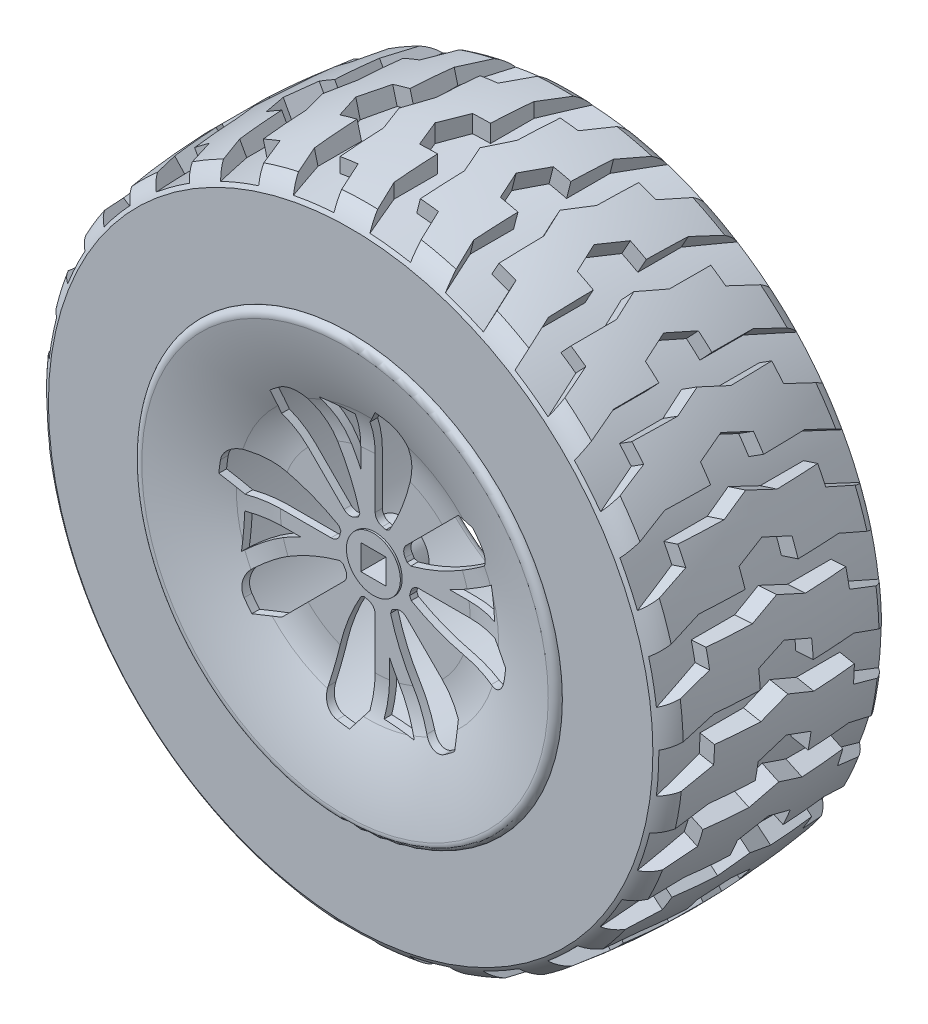
from build123d import *

# Parameters (mm, degrees)
SKETCH1_R           = 42.5
BOSS_EXTRUDE1_DEPTH = 31.5
BOSS_EXTRUDE2_DEPTH = 45
CIRPATTERN1_COUNT   = 25
SKETCH9_W           = 3.5
SKETCH9_H           = 3.5
CUT_EXTRUDE1_DEPTH  = 69.426549581


with BuildPart() as part:
    # Sketch1 → Boss-Extrude1 (new body)
    with BuildSketch(Plane.XY):
        Circle(SKETCH1_R)
    extrude(amount=BOSS_EXTRUDE1_DEPTH)

    # Sketch2 → Boss-Extrude2 (add)
    with BuildSketch(Plane(origin=(0, 0, 0), x_dir=(1, 0, 0), z_dir=(0, 1, 0))):
        Polygon((-2.5, 0), (2.5, 0), (0, -6.035533906), (0, -12.071067812), (-2.5, -12.071067812), (-4.023863607, -15.75), (-2.5, -19.428932188), (0, -19.428932188), (0, -25.464466094), (2.5, -31.5), (-2.5, -31.5), (-5, -25.464466094), (-7.5, -25.464466094), (-7.5, -19.428932188), (-9.023863607, -15.75), (-7.5, -12.071067812), (-7.5, -6.035533906), (-5, -6.035533906), align=None)
    boss_extrude2 = extrude(amount=BOSS_EXTRUDE2_DEPTH)

    # CirPattern1: Boss-Extrude2 ×25 about axis
    cirpattern1_axis = Axis((0, 0, 0), (0, 0, 1))
    for i in range(1, CIRPATTERN1_COUNT):
        add(boss_extrude2.rotate(cirpattern1_axis, i * 360 / CIRPATTERN1_COUNT))

    # Sketch4 → Cut-Revolve9 (revolve, cut)
    with BuildSketch(Plane(origin=(0, 0, 0), x_dir=(0, 0, -1), z_dir=(1, 0, 0)), mode=Mode.PRIVATE) as cut_revolve9_sk:
        with BuildLine():
            Line((-31.5, 29.431219638), (-31.5, 41.994319309))
            ThreePointArc((-31.5, 41.994319309), (-30.583805761, 43.197023278), (-29.35, 44.070883715))
            ThreePointArc((-29.35, 44.070883715), (-22.565850223, 44.767450532), (-15.75, 45))
            Line((-15.75, 45), (-15.75, 50.330506558))
            Line((-15.75, 50.330506558), (-40.75, 50.330506558))
            Line((-40.75, 50.330506558), (-40.75, 22.5))
            Line((-40.75, 22.5), (-31.5, 22.5))
            Line((-31.5, 22.5), (-29.75, 22.5))
            ThreePointArc((-29.75, 22.5), (-30.758394653, 25.931930228), (-31.5, 29.431219638))
        make_face()
        with BuildLine():
            Line((-15.75, 50.330506558), (-15.75, 45))
            ThreePointArc((-15.75, 45), (-8.934149777, 44.767450532), (-2.15, 44.070883715))
            ThreePointArc((-2.15, 44.070883715), (-0.916194239, 43.197023278), (0, 41.994319309))
            Line((0, 41.994319309), (0, 29.431219638))
            ThreePointArc((0, 29.431219638), (-0.741605347, 25.931930228), (-1.75, 22.5))
            Line((-1.75, 22.5), (0, 22.5))
            Line((0, 22.5), (9.25, 22.5))
            Line((9.25, 22.5), (9.25, 50.330506558))
            Line((9.25, 50.330506558), (-15.75, 50.330506558))
        make_face()
        Polygon((-1.75, 22.5), (-29.75, 22.5), (-31.5, 22.5), (-31.5, 0), (0, 0), (0, 22.5), align=None)
    revolve(cut_revolve9_sk.sketch.rotate(Axis((0, 0, 31.5), (0, 0, -1)), 90), axis=Axis((0, 0, 31.5), (0, 0, -1)), mode=Mode.SUBTRACT)

    # Sketch6 → Cut-Revolve14 (revolve, cut)
    with BuildSketch(Plane(origin=(0, 0, 0), x_dir=(0, 0, -1), z_dir=(1, 0, 0)), mode=Mode.PRIVATE) as cut_revolve14_sk:
        with BuildLine():
            Line((-1.75, 37.057556582), (-1.75, 29.582097187))
            ThreePointArc((-1.75, 29.582097187), (-2.456535486, 26.288589214), (-3.408803984, 23.057556582))
            Line((-3.408803984, 23.057556582), (-3.408803984, 20.557556582))
            ThreePointArc((-3.408803984, 20.557556582), (-4.141037031, 18.789789629), (-5.908803984, 18.057556582))
            Line((-5.908803984, 18.057556582), (-25.591196016, 18.057556582))
            ThreePointArc((-25.591196016, 18.057556582), (-27.358962969, 18.789789629), (-28.091196016, 20.557556582))
            Line((-28.091196016, 20.557556582), (-28.091196016, 23.057556582))
            ThreePointArc((-28.091196016, 23.057556582), (-29.043464514, 26.288589214), (-29.75, 29.582097187))
            Line((-29.75, 29.582097187), (-29.75, 37.057556582))
            ThreePointArc((-29.75, 37.057556582), (-29.017766953, 38.825323535), (-27.25, 39.557556582))
            Line((-27.25, 39.557556582), (-4.25, 39.557556582))
            ThreePointArc((-4.25, 39.557556582), (-2.482233047, 38.825323535), (-1.75, 37.057556582))
        make_face()
    revolve(cut_revolve14_sk.sketch.rotate(Axis((0, 0, 31.5), (0, 0, -1)), 90), axis=Axis((0, 0, 31.5), (0, 0, -1)), mode=Mode.SUBTRACT)


with BuildPart() as body_2:
    # Sketch8 → Revolve1 (revolve)
    with BuildSketch(Plane(origin=(0, 0, 0), x_dir=(0, 0, -1), z_dir=(1, 0, 0)), mode=Mode.PRIVATE) as revolve1_sk:
        with BuildLine():
            ThreePointArc((-29.75, 22.5), (-30.756022572, 25.922539253), (-31.496711617, 29.412128927))
            ThreePointArc((-31.496711617, 29.412128927), (-32.132409039, 28.988739986), (-32.283814603, 28.24011073))
            ThreePointArc((-32.283814603, 28.24011073), (-30.993726951, 23.139243935), (-29.147244982, 18.212412038))
            ThreePointArc((-29.147244982, 18.212412038), (-28.358056846, 15.753000965), (-28.091196016, 13.183894887))
            Line((-28.091196016, 13.183894887), (-28.091196016, 3.75))
            Line((-28.091196016, 3.75), (-28.341196016, 3.75))
            Line((-28.341196016, 3.75), (-28.341196016, 0))
            Line((-28.341196016, 0), (-24.341196016, 0))
            Line((-24.341196016, 0), (-24.341196016, 3.75))
            Line((-24.341196016, 3.75), (-27.091196016, 3.75))
            Line((-27.091196016, 3.75), (-27.091196016, 13.183894887))
            ThreePointArc((-27.091196016, 13.183894887), (-27.379405712, 15.958529451), (-28.231728899, 18.61469341))
            ThreePointArc((-28.231728899, 18.61469341), (-28.555555113, 19.369705709), (-28.865988218, 20.130322746))
            ThreePointArc((-28.865988218, 20.130322746), (-28.764377764, 21.061392352), (-27.936827991, 21.5))
            Line((-27.936827991, 21.5), (-1.75, 21.5))
            ThreePointArc((-1.75, 21.5), (-1.178621124, 21.683992138), (-0.821968915, 22.166823505))
            ThreePointArc((-0.821968915, 22.166823505), (0.081463726, 25.176884003), (0.783814603, 28.24011073))
            ThreePointArc((0.783814603, 28.24011073), (0.632409039, 28.988739986), (-0.003288383, 29.412128927))
            ThreePointArc((-0.003288383, 29.412128927), (-0.743977428, 25.922539253), (-1.75, 22.5))
            Line((-1.75, 22.5), (-29.75, 22.5))
        make_face()
    revolve(revolve1_sk.sketch.rotate(Axis((0, 0, 31.5), (0, 0, -1)), 90), axis=Axis((0, 0, 31.5), (0, 0, -1)))

    # Sketch9 → Cut-Extrude1 (cut, through all)
    with BuildSketch(Plane(origin=(0, 0, 24.341196016), x_dir=(-1, 0, 0), z_dir=(0, 0, -1))):
        Rectangle(SKETCH9_W, SKETCH9_H)
        with BuildLine():
            Line((0, 6.123724357), (0, 17.357623722))
            Line((0, 17.357623722), (-1.765696611, 19.921905418))
            ThreePointArc((-1.765696611, 19.921905418), (-2.642314511, 19.824685975), (-3.5137937, 19.688911952))
            ThreePointArc((-3.5137937, 19.688911952), (-5.034883264, 18.779303645), (-5.570765941, 17.089945633))
            ThreePointArc((-5.570765941, 17.089945633), (-4.486967211, 10.840322898), (-1.988947371, 5.010031232))
            Line((-1.988947371, 5.010031232), (-1.496142559, 4.770907402))
            ThreePointArc((-1.496142559, 4.770907402), (-1.249712981, 4.841303282), (-1, 4.898979486))
            ThreePointArc((-1, 4.898979486), (-0.281754163, 5.333154942), (0, 6.123724357))
        make_face()
        with BuildLine():
            Line((-4.330127019, 4.330127019), (-12.273693439, 12.273693439))
            Line((-12.273693439, 12.273693439), (-15.335450462, 12.838378368))
            ThreePointArc((-15.335450462, 12.838378368), (-15.886568397, 12.149771379), (-16.406790508, 11.437535802))
            ThreePointArc((-16.406790508, 11.437535802), (-16.839173052, 9.718772855), (-16.023542821, 8.145290074))
            ThreePointArc((-16.023542821, 8.145290074), (-10.838030773, 4.492500889), (-4.949025232, 2.136228884))
            Line((-4.949025232, 2.136228884), (-4.431473526, 2.315608427))
            ThreePointArc((-4.431473526, 2.315608427), (-4.306998903, 2.539637857), (-4.171208396, 2.756994834))
            ThreePointArc((-4.171208396, 2.756994834), (-3.970340304, 3.571879745), (-4.330127019, 4.330127019))
        make_face()
        with BuildLine():
            Line((-6.123724357, 0), (-17.357623722, 0))
            Line((-17.357623722, 0), (-19.921905418, -1.765696611))
            ThreePointArc((-19.921905418, -1.765696611), (-19.824685975, -2.642314511), (-19.688911952, -3.5137937))
            ThreePointArc((-19.688911952, -3.5137937), (-18.779303645, -5.034883264), (-17.089945633, -5.570765941))
            ThreePointArc((-17.089945633, -5.570765941), (-10.840322898, -4.486967211), (-5.010031232, -1.988947371))
            Line((-5.010031232, -1.988947371), (-4.770907402, -1.496142559))
            ThreePointArc((-4.770907402, -1.496142559), (-4.841303282, -1.249712981), (-4.898979486, -1))
            ThreePointArc((-4.898979486, -1), (-5.333154942, -0.281754163), (-6.123724357, 0))
        make_face()
        with BuildLine():
            Line((-4.330127019, -4.330127019), (-12.273693439, -12.273693439))
            Line((-12.273693439, -12.273693439), (-12.838378368, -15.335450462))
            ThreePointArc((-12.838378368, -15.335450462), (-12.149771379, -15.886568397), (-11.437535802, -16.406790508))
            ThreePointArc((-11.437535802, -16.406790508), (-9.718772855, -16.839173052), (-8.145290074, -16.023542821))
            ThreePointArc((-8.145290074, -16.023542821), (-4.492500889, -10.838030773), (-2.136228884, -4.949025232))
            Line((-2.136228884, -4.949025232), (-2.315608427, -4.431473526))
            ThreePointArc((-2.315608427, -4.431473526), (-2.539637857, -4.306998903), (-2.756994834, -4.171208396))
            ThreePointArc((-2.756994834, -4.171208396), (-3.571879745, -3.970340304), (-4.330127019, -4.330127019))
        make_face()
        with BuildLine():
            Line((0, -6.123724357), (0, -17.357623722))
            Line((0, -17.357623722), (1.765696611, -19.921905418))
            ThreePointArc((1.765696611, -19.921905418), (2.642314511, -19.824685975), (3.5137937, -19.688911952))
            ThreePointArc((3.5137937, -19.688911952), (5.034883264, -18.779303645), (5.570765941, -17.089945633))
            ThreePointArc((5.570765941, -17.089945633), (4.486967211, -10.840322898), (1.988947371, -5.010031232))
            Line((1.988947371, -5.010031232), (1.496142559, -4.770907402))
            ThreePointArc((1.496142559, -4.770907402), (1.249712981, -4.841303282), (1, -4.898979486))
            ThreePointArc((1, -4.898979486), (0.281754163, -5.333154942), (0, -6.123724357))
        make_face()
        with BuildLine():
            Line((4.330127019, -4.330127019), (12.273693439, -12.273693439))
            Line((12.273693439, -12.273693439), (15.335450462, -12.838378368))
            ThreePointArc((15.335450462, -12.838378368), (15.886568397, -12.149771379), (16.406790508, -11.437535802))
            ThreePointArc((16.406790508, -11.437535802), (16.839173052, -9.718772855), (16.023542821, -8.145290074))
            ThreePointArc((16.023542821, -8.145290074), (10.838030773, -4.492500889), (4.949025232, -2.136228884))
            Line((4.949025232, -2.136228884), (4.431473526, -2.315608427))
            ThreePointArc((4.431473526, -2.315608427), (4.306998903, -2.539637857), (4.171208396, -2.756994834))
            ThreePointArc((4.171208396, -2.756994834), (3.970340304, -3.571879745), (4.330127019, -4.330127019))
        make_face()
        with BuildLine():
            Line((6.123724357, 0), (17.357623722, 0))
            Line((17.357623722, 0), (19.921905418, 1.765696611))
            ThreePointArc((19.921905418, 1.765696611), (19.824685975, 2.642314511), (19.688911952, 3.5137937))
            ThreePointArc((19.688911952, 3.5137937), (18.779303645, 5.034883264), (17.089945633, 5.570765941))
            ThreePointArc((17.089945633, 5.570765941), (10.840322898, 4.486967211), (5.010031232, 1.988947371))
            Line((5.010031232, 1.988947371), (4.770907402, 1.496142559))
            ThreePointArc((4.770907402, 1.496142559), (4.841303282, 1.249712981), (4.898979486, 1))
            ThreePointArc((4.898979486, 1), (5.333154942, 0.281754163), (6.123724357, 0))
        make_face()
        with BuildLine():
            Line((4.330127019, 4.330127019), (12.273693439, 12.273693439))
            Line((12.273693439, 12.273693439), (12.838378368, 15.335450462))
            ThreePointArc((12.838378368, 15.335450462), (12.149771379, 15.886568397), (11.437535802, 16.406790508))
            ThreePointArc((11.437535802, 16.406790508), (9.718772855, 16.839173052), (8.145290074, 16.023542821))
            ThreePointArc((8.145290074, 16.023542821), (4.492500889, 10.838030773), (2.136228884, 4.949025232))
            Line((2.136228884, 4.949025232), (2.315608427, 4.431473526))
            ThreePointArc((2.315608427, 4.431473526), (2.539637857, 4.306998903), (2.756994834, 4.171208396))
            ThreePointArc((2.756994834, 4.171208396), (3.571879745, 3.970340304), (4.330127019, 4.330127019))
        make_face()
        with BuildLine():
            Line((2, 10.343566269), (2, 17.357623722))
            Line((2, 17.357623722), (6.655247072, 17.357623722))
            ThreePointArc((6.655247072, 17.357623722), (4.074183846, 14.018803537), (2, 10.343566269))
        make_face()
        with BuildLine():
            Line((10.343566269, -2), (17.357623722, -2))
            Line((17.357623722, -2), (17.357623722, -6.655247072))
            ThreePointArc((17.357623722, -6.655247072), (14.018803537, -4.074183846), (10.343566269, -2))
        make_face()
        with BuildLine():
            Line((-2, -10.343566269), (-2, -17.357623722))
            Line((-2, -17.357623722), (-6.655247072, -17.357623722))
            ThreePointArc((-6.655247072, -17.357623722), (-4.074183846, -14.018803537), (-2, -10.343566269))
        make_face()
        with BuildLine():
            Line((-10.343566269, 2), (-17.357623722, 2))
            Line((-17.357623722, 2), (-17.357623722, 6.655247072))
            ThreePointArc((-17.357623722, 6.655247072), (-14.018803537, 4.074183846), (-10.343566269, 2))
        make_face()
    extrude(amount=-CUT_EXTRUDE1_DEPTH, mode=Mode.SUBTRACT)


solid = Compound([part.part, body_2.part])
